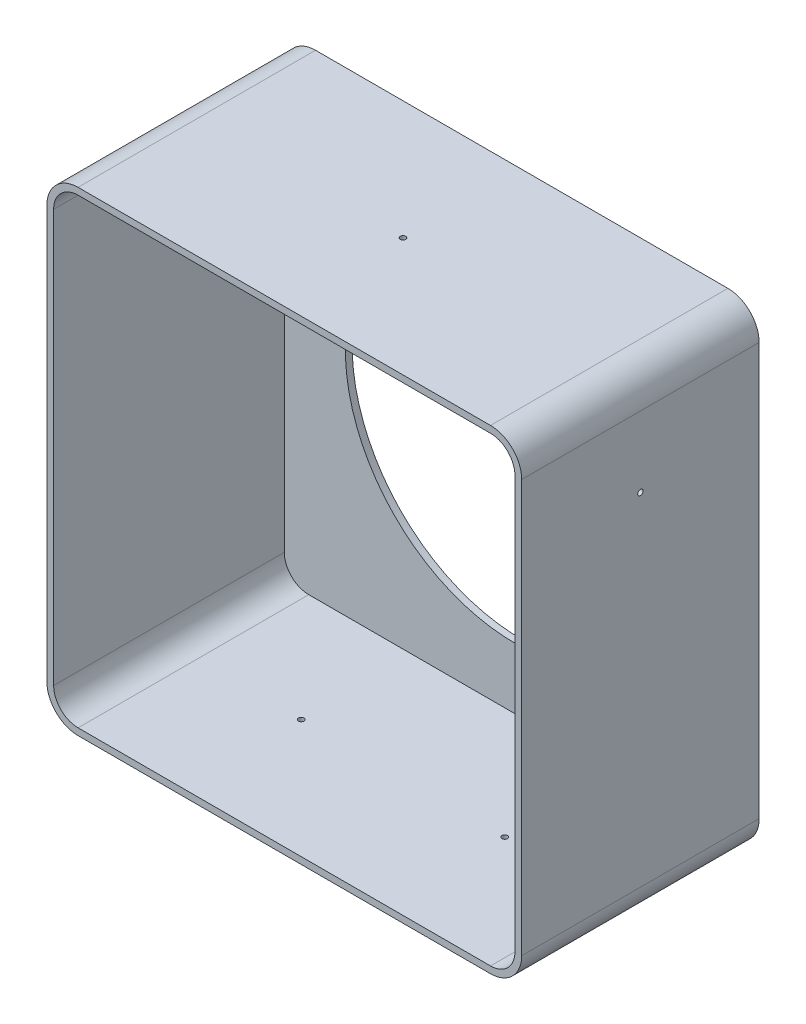
from build123d import *

# Parameters (mm, degrees)
SKETCH1_R           = 25
BOSS_EXTRUDE1_DEPTH = 35
CUT_EXTRUDE1_DEPTH  = 34
SKETCH3_R           = 0.4
CUT_EXTRUDE2_DEPTH  = 78
SKETCH4_R           = 0.4
CUT_EXTRUDE3_DEPTH  = 22
SKETCH5_R           = 0.4
CUT_EXTRUDE4_DEPTH  = 10


with BuildPart() as part:
    # Sketch1 → Boss-Extrude1 (new body)
    with BuildSketch(Plane.XY):
        with BuildLine():
            Line((-30.39566951, 35), (30.39566951, 35))
            ThreePointArc((30.39566951, 35), (33.651422822, 33.651422822), (35, 30.39566951))
            Line((35, 30.39566951), (35, -30.39566951))
            ThreePointArc((35, -30.39566951), (33.651422822, -33.651422822), (30.39566951, -35))
            Line((30.39566951, -35), (-30.39566951, -35))
            ThreePointArc((-30.39566951, -35), (-33.651422822, -33.651422822), (-35, -30.39566951))
            Line((-35, -30.39566951), (-35, 30.39566951))
            ThreePointArc((-35, 30.39566951), (-33.651422822, 33.651422822), (-30.39566951, 35))
        make_face()
        Circle(SKETCH1_R, mode=Mode.SUBTRACT)
    extrude(amount=BOSS_EXTRUDE1_DEPTH)

    # Sketch2 → Cut-Extrude1 (cut)
    with BuildSketch(Plane.XY.offset(35)):
        with BuildLine():
            Line((-30.39566951, -34), (30.39566951, -34))
            ThreePointArc((30.39566951, -34), (32.944316041, -32.944316041), (34, -30.39566951))
            Line((34, -30.39566951), (34, 30.39566951))
            ThreePointArc((34, 30.39566951), (32.944316041, 32.944316041), (30.39566951, 34))
            Line((30.39566951, 34), (-30.39566951, 34))
            ThreePointArc((-30.39566951, 34), (-32.944316041, 32.944316041), (-34, 30.39566951))
            Line((-34, 30.39566951), (-34, -30.39566951))
            ThreePointArc((-34, -30.39566951), (-32.944316041, -32.944316041), (-30.39566951, -34))
        make_face()
    extrude(amount=-CUT_EXTRUDE1_DEPTH, mode=Mode.SUBTRACT)

    # Sketch3 → Cut-Extrude2 (cut)
    with BuildSketch(Plane(origin=(35, 0, 0), x_dir=(0, 0, -1), z_dir=(1, 0, 0))):
        with Locations(Location((-17.5, 20, 0), (0, 0, 90))):
            Circle(SKETCH3_R)
    extrude(amount=-CUT_EXTRUDE2_DEPTH, mode=Mode.SUBTRACT)

    # Sketch4 → Cut-Extrude3 (cut)
    with BuildSketch(Plane(origin=(0, 35, 0), x_dir=(1, 0, 0), z_dir=(0, 1, 0))):
        with Locations(Location((0, -17.5, 0), (0, 0, 270))):
            Circle(SKETCH4_R)
    extrude(amount=-CUT_EXTRUDE3_DEPTH, mode=Mode.SUBTRACT)

    # Sketch5 → Cut-Extrude4 (cut)
    with BuildSketch(Plane.XZ.offset(35)):
        with Locations(Location((-15, 17.5, 0), (0, 0, 270))):
            Circle(SKETCH5_R)
        with Locations(Location((15, 17.5, 0), (0, 0, 270))):
            Circle(SKETCH5_R)
    extrude(amount=-CUT_EXTRUDE4_DEPTH, mode=Mode.SUBTRACT)


solid = part.part
